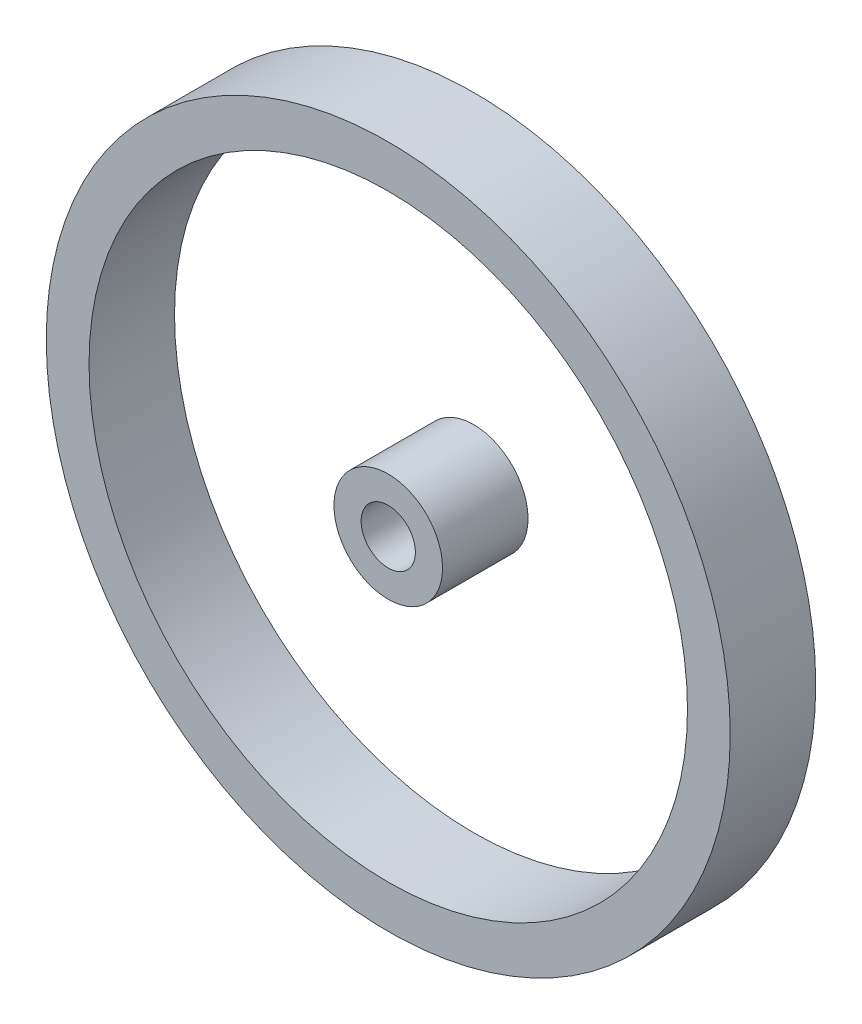
from build123d import *

# Parameters (mm, degrees)
SKETCH1_R             = 40
SKETCH1_R_2           = 35
BOSS_EXTRUDE1_DEPTH   = 10
SKETCH1_R_3           = 6.35
SKETCH1_R_4           = 3.175
BOSS_EXTRUDE1_2_DEPTH = 10


with BuildPart() as part:
    # Sketch1 → Boss-Extrude1 (new body)
    with BuildSketch(Plane.XY):
        Circle(SKETCH1_R)
        Circle(SKETCH1_R_2, mode=Mode.SUBTRACT)
    extrude(amount=BOSS_EXTRUDE1_DEPTH)


with BuildPart() as body_2:
    # Sketch1 → Boss-Extrude1 2 (new body)
    with BuildSketch(Plane.XY):
        Circle(SKETCH1_R_3)
        Circle(SKETCH1_R_4, mode=Mode.SUBTRACT)
    extrude(amount=BOSS_EXTRUDE1_2_DEPTH)


solid = Compound([part.part, body_2.part])
